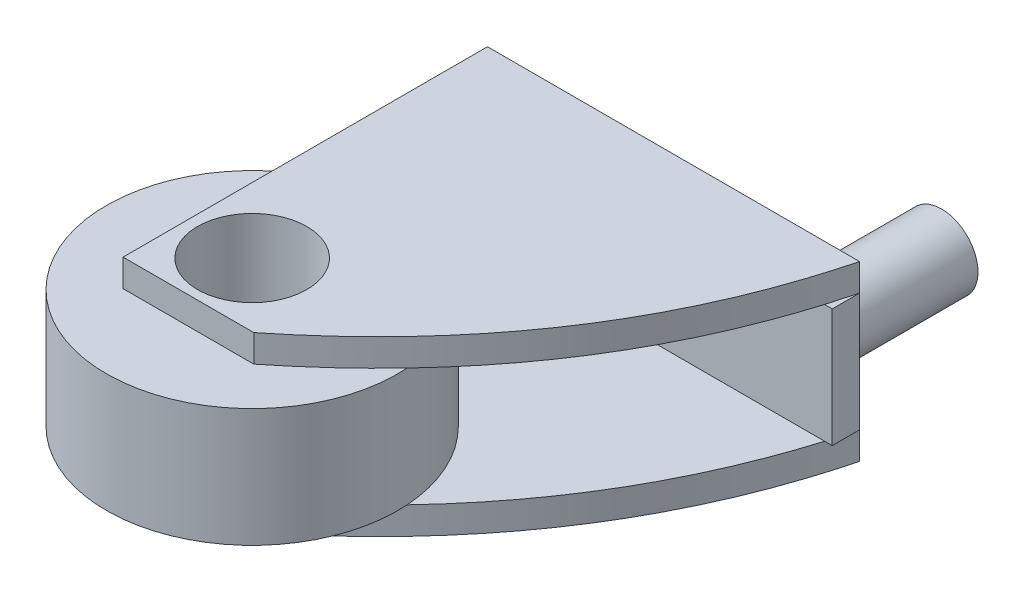
from build123d import *

# Parameters (mm, degrees)
SKETCH_1_R          = 16
SKETCH_1_R_2        = 6
EXTRUDE_1_DEPTH     = 13
EXTRUDE_2_DEPTH     = 3
SKETCH_3_W          = 40.839919316
SKETCH_3_H          = 13
EXTRUDE_3_DEPTH     = 3
SKETCH_4_R          = 4
EXTRUDE_4_DEPTH     = 15
SKETCH_5_R          = 6
CUT_EXTRUDE_1_DEPTH = 30


with BuildPart() as part:
    # 草图1 → 凸台-拉伸1 (new body)
    with BuildSketch(Plane(origin=(0, 0, 0), x_dir=(1, 0, 0), z_dir=(0, 1, 0))):
        with Locations(Location((0, 0, 0), (0, 0, 90))):
            Circle(SKETCH_1_R)
        with Locations(Location((0, 0, 0), (0, 0, 90))):
            Circle(SKETCH_1_R_2, mode=Mode.SUBTRACT)
    extrude(amount=EXTRUDE_1_DEPTH)

    # 草图2 → 凸台-拉伸2 (add)
    with BuildSketch(Plane(origin=(0, 13, 0), x_dir=(1, 0, 0), z_dir=(0, 1, 0))):
        with BuildLine():
            Line((-7.174258512, -6.994775102), (7.174258512, -6.994775102))
            add(Edge.make_bspline(
                [(33.665660804, 33), (27.50458158, 9.184496857), (7.174258512, -6.994775102)],
                knots=[0, 0, 0, 1, 1, 1], degree=2))
            Line((33.665660804, 33), (7.174258512, 33))
            Line((7.174258512, 33), (-7.174258512, 33))
            Line((-7.174258512, 33), (-7.174258512, -6.994775102))
        make_face()
    extrude_2 = extrude(amount=EXTRUDE_2_DEPTH)

    # 镜向1: 凸台-拉伸2 across plane
    add(extrude_2.mirror(Plane.ZX.offset(6.5)))

    # 草图3 → 凸台-拉伸3 (add)
    with BuildSketch(Plane(origin=(0, 0, -33), x_dir=(-1, 0, 0), z_dir=(0, 0, -1))):
        with Locations((-13.245701146, 6.5)):
            Rectangle(SKETCH_3_W, SKETCH_3_H)
    extrude(amount=-EXTRUDE_3_DEPTH)

    # 草图4 → 凸台-拉伸4 (add)
    with BuildSketch(Plane(origin=(0, 0, -33), x_dir=(-1, 0, 0), z_dir=(0, 0, -1))):
        with Locations(Location((-27.665660804, 6.5, 0), (0, 0, 180))):
            Circle(SKETCH_4_R)
    extrude(amount=EXTRUDE_4_DEPTH)

    # 草图5 → 切除-拉伸1 (cut)
    with BuildSketch(Plane.XZ.offset(3)):
        with Locations(Location((0, 0, 0), (0, 0, 270))):
            Circle(SKETCH_5_R)
    extrude(amount=-CUT_EXTRUDE_1_DEPTH, mode=Mode.SUBTRACT)


solid = part.part
